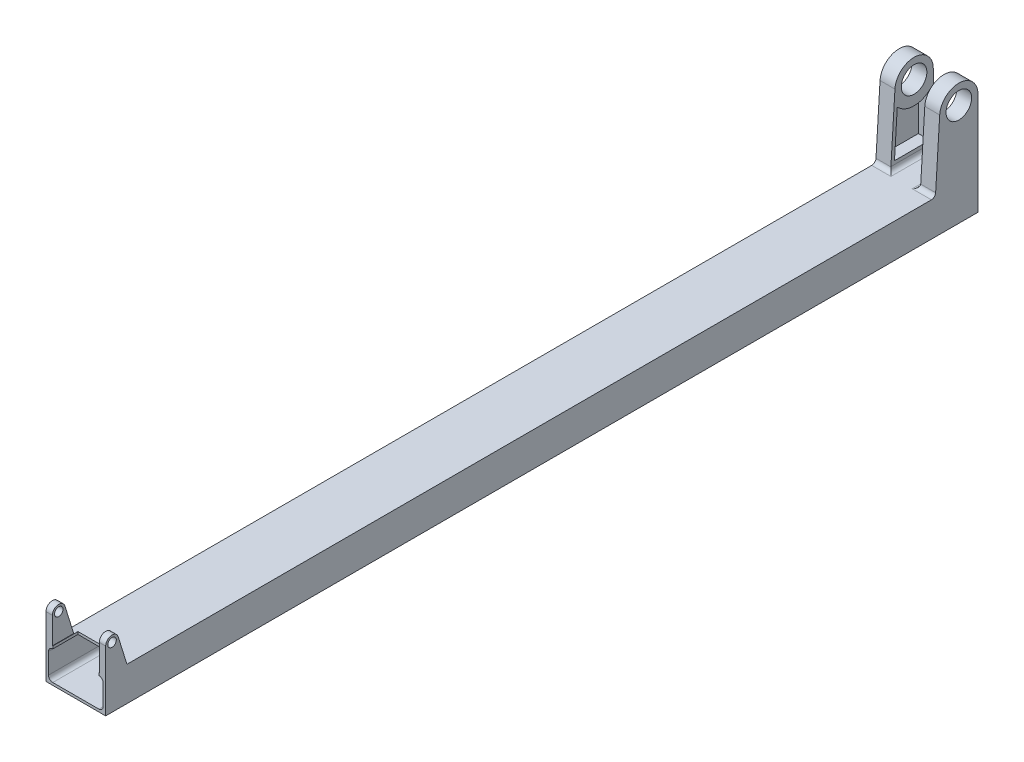
from build123d import *

# Parameters (mm, degrees)
SKETCH2_W               = 177.8
SKETCH2_H               = 101.6
SKETCH2_W_2             = 162.8
SKETCH2_H_2             = 86.6
BOSS_EXTRUDE2_DEPTH     = 2600
SKETCH1_R               = 38.1
BOSS_EXTRUDE3_DEPTH     = 44.45
BOSS_EXTRUDE5_START     = -44.45
SKETCH3_R               = 38.1
BOSS_EXTRUDE5_DEPTH     = 44.45
FILLET1_R               = 12.7
FILLET2_R               = 12.7
SKETCH5_R               = 12.7
BOSS_EXTRUDE7_DEPTH     = 19.05
CUT_EXTRUDE1_DEPTH      = 34.45
CUT_EXTRUDE2_DEPTH      = 2620.044665999
CUT_EXTRUDE2_DEPTH_BACK = 2620.044665999
SKETCH9_W               = 88.9
SKETCH9_H               = 2600
SKETCH10_W              = 137.4
SKETCH10_H              = 75
CUT_EXTRUDE3_DEPTH      = 10


with BuildPart() as part:
    # Sketch2 → Boss-Extrude2 (new body)
    with BuildSketch(Plane.XY):
        with Locations((-88.9, 50.8)):
            Rectangle(SKETCH2_W, SKETCH2_H)
        with Locations((-88.9, 50.8)):
            Rectangle(SKETCH2_W_2, SKETCH2_H_2, mode=Mode.SUBTRACT)
    extrude(amount=BOSS_EXTRUDE2_DEPTH)

    # Sketch1 → Boss-Extrude3 (add)
    with BuildSketch(Plane(origin=(0, 0, 0), x_dir=(0, 0, -1), z_dir=(1, 0, 0))):
        with BuildLine():
            Line((-127, 101.6), (0, 101.6))
            Line((0, 101.6), (0, 304.8))
            ThreePointArc((0, 304.8), (-55.382017361, 361.922646449), (-114.190611982, 308.334272869))
            Line((-114.190611982, 308.334272869), (-127, 101.6))
        make_face()
        with Locations((-57.15, 304.8)):
            Circle(SKETCH1_R, mode=Mode.SUBTRACT)
    extrude(amount=-BOSS_EXTRUDE3_DEPTH)

    # Sketch3 → Boss-Extrude5 (add)
    with BuildSketch(Plane.ZY.offset(177.8).offset(BOSS_EXTRUDE5_START)):
        with BuildLine():
            Line((0, 304.8), (0, 101.6))
            Line((0, 101.6), (127, 101.6))
            Line((127, 101.6), (114.190611982, 308.334272869))
            ThreePointArc((114.190611982, 308.334272869), (55.382017361, 361.922646449), (0, 304.8))
        make_face()
        with Locations(Location((57.15, 304.8, 0), (0, 0, 180))):
            Circle(SKETCH3_R, mode=Mode.SUBTRACT)
    extrude(amount=BOSS_EXTRUDE5_DEPTH)

    # Fillet1
    fillet1_edges = [part.edges().sort_by_distance(p)[0] for p in [
        (-7.5, 94.1, 1300),
        (-170.3, 94.1, 1300),
        (-170.3, 7.5, 1300),
        (-7.5, 7.5, 1300),
    ]]
    fillet(fillet1_edges, radius=FILLET1_R)

    # Fillet2
    fillet2_edges = [part.edges().sort_by_distance(p)[0] for p in [
        (-44.45, 101.6, 63.5),
        (-22.225, 101.6, 127),
        (-133.35, 101.6, 63.5),
        (-155.575, 101.6, 127),
    ]]
    fillet(fillet2_edges, radius=FILLET2_R)

    # Sketch5 → Boss-Extrude7 (add)
    with BuildSketch(Plane(origin=(0, 0, 0), x_dir=(0, 0, -1), z_dir=(1, 0, 0))):
        with BuildLine():
            Line((-2600, 101.6), (-2600, 180.34))
            ThreePointArc((-2600, 180.34), (-2583.812295525, 199.173740052), (-2562.760129729, 185.999604185))
            Line((-2562.760129729, 185.999604185), (-2536.5, 101.6))
            Line((-2536.5, 101.6), (-2600, 101.6))
        make_face()
        with Locations((-2580.95, 180.34)):
            Circle(SKETCH5_R, mode=Mode.SUBTRACT)
    boss_extrude7 = extrude(amount=-BOSS_EXTRUDE7_DEPTH)

    # Mirror1: Boss-Extrude7 across plane
    add(boss_extrude7.mirror(Plane.ZY.offset(88.9)))

    # Sketch8 → Cut-Extrude1 (cut)
    with BuildSketch(Plane(origin=(-133.35, 0, 0), x_dir=(0, 0, -1), z_dir=(1, 0, 0))):
        with BuildLine():
            ThreePointArc((-10, 255.662565187), (-59.256729969, 236.73259452), (-107.248511945, 258.672469165))
            Line((-107.248511945, 258.672469165), (-115.574316238, 124.3))
            Line((-115.574316238, 124.3), (-10, 124.3))
            Line((-10, 124.3), (-10, 255.662565187))
        make_face()
    extrude(amount=-CUT_EXTRUDE1_DEPTH, mode=Mode.SUBTRACT)

    # Sketch9 → Cut-Extrude2 (cut, two sides: drawn at the far end of the back side and taken through both)
    with BuildSketch(Plane(origin=(0, 101.6, 0), x_dir=(1, 0, 0), z_dir=(0, 1, 0)).offset(-CUT_EXTRUDE2_DEPTH_BACK)):
        with Locations((-44.45, -1300)):
            Rectangle(SKETCH9_W, SKETCH9_H)
    extrude(amount=CUT_EXTRUDE2_DEPTH + CUT_EXTRUDE2_DEPTH_BACK, mode=Mode.SUBTRACT)

    # Mirror2: part across plane


with BuildPart() as part_1:
    add(part.part)
    add(part.part.mirror(Plane.ZY.offset(88.9)))

    # Sketch10 → Cut-Extrude3 (cut)
    with BuildSketch(Plane.XZ.offset(-94.1)):
        with Locations((-88.9, 2562.5)):
            Rectangle(SKETCH10_W, SKETCH10_H)
    extrude(amount=-CUT_EXTRUDE3_DEPTH, mode=Mode.SUBTRACT)


solid = part_1.part
